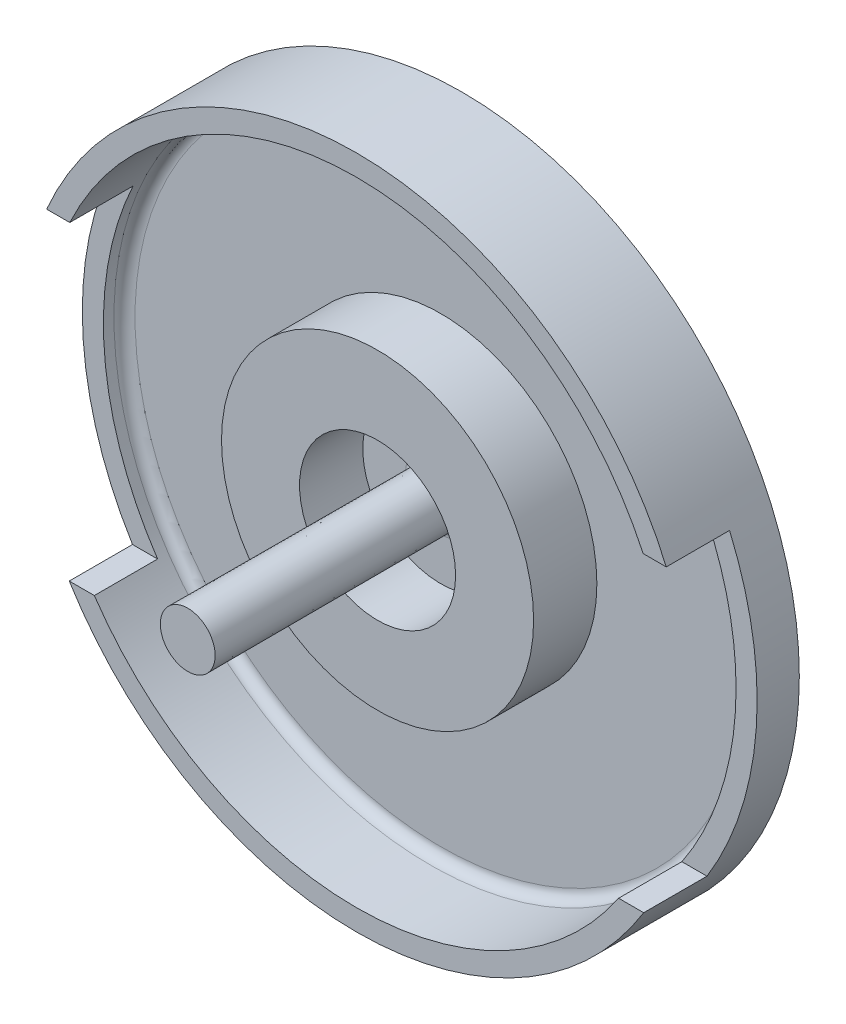
from build123d import *

# Parameters (mm, degrees)
SKETCH1_R           = 16
BOSS_EXTRUDE1_DEPTH = 5
SKETCH3_R           = 15
CUT_EXTRUDE1_DEPTH  = 4
FILLET1_R           = 0.5
SKETCH7_W           = 5.268501054
SKETCH7_H           = 14.735182388
CUT_EXTRUDE2_DEPTH  = 11
SKETCH8_R           = 7.4
BOSS_EXTRUDE2_DEPTH = 3
SKETCH9_R           = 3.7
CUT_EXTRUDE3_DEPTH  = 3
SKETCH5_R           = 1.275
SKETCH6_R           = 1.3
FILLET3_R           = 0.4


with BuildPart() as part:
    # Sketch1 → Boss-Extrude1 (new body)
    with BuildSketch(Plane.XY):
        Circle(SKETCH1_R)
    extrude(amount=BOSS_EXTRUDE1_DEPTH)

    # Sketch3 → Cut-Extrude1 (cut)
    with BuildSketch(Plane.XY.offset(5)):
        Circle(SKETCH3_R)
    extrude(amount=-CUT_EXTRUDE1_DEPTH, mode=Mode.SUBTRACT)

    # Fillet1
    fillet1_edges = [part.edges().sort_by_distance(p)[0] for p in [
        (-15, 0, 1),
    ]]
    fillet(fillet1_edges, radius=FILLET1_R)

    # Sketch7 → Cut-Extrude2 (cut)
    with BuildSketch(Plane.XY.offset(13)):
        with Locations((-14.456252894, -1.028256592)):
            Rectangle(SKETCH7_W, SKETCH7_H)
    cut_extrude2 = extrude(amount=-CUT_EXTRUDE2_DEPTH, mode=Mode.SUBTRACT)

    # Mirror1: Cut-Extrude2 across plane
    add(cut_extrude2.mirror(Plane(origin=(0, 0, 0), x_dir=(0, 0, 1), z_dir=(1, 0, 0))), mode=Mode.SUBTRACT)

    # Sketch8 → Boss-Extrude2 (add)
    with BuildSketch(Plane.XY.offset(1)):
        Circle(SKETCH8_R)
    extrude(amount=BOSS_EXTRUDE2_DEPTH)

    # Sketch9 → Cut-Extrude3 (cut)
    with BuildSketch(Plane.XY.offset(4)):
        Circle(SKETCH9_R)
    extrude(amount=-CUT_EXTRUDE3_DEPTH, mode=Mode.SUBTRACT)

    # Sketch5 → Loft1 section 0
    with BuildSketch(Plane.XY.offset(1)):
        Circle(SKETCH5_R)
    # Sketch6 → Loft1 section 1
    with BuildSketch(Plane.XY.offset(13)):
        Circle(SKETCH6_R)
    loft()

    # Fillet3
    fillet3_edges = [part.edges().sort_by_distance(p)[0] for p in [
        (-1.275, 0, 1),
    ]]
    fillet(fillet3_edges, radius=FILLET3_R)


solid = part.part
